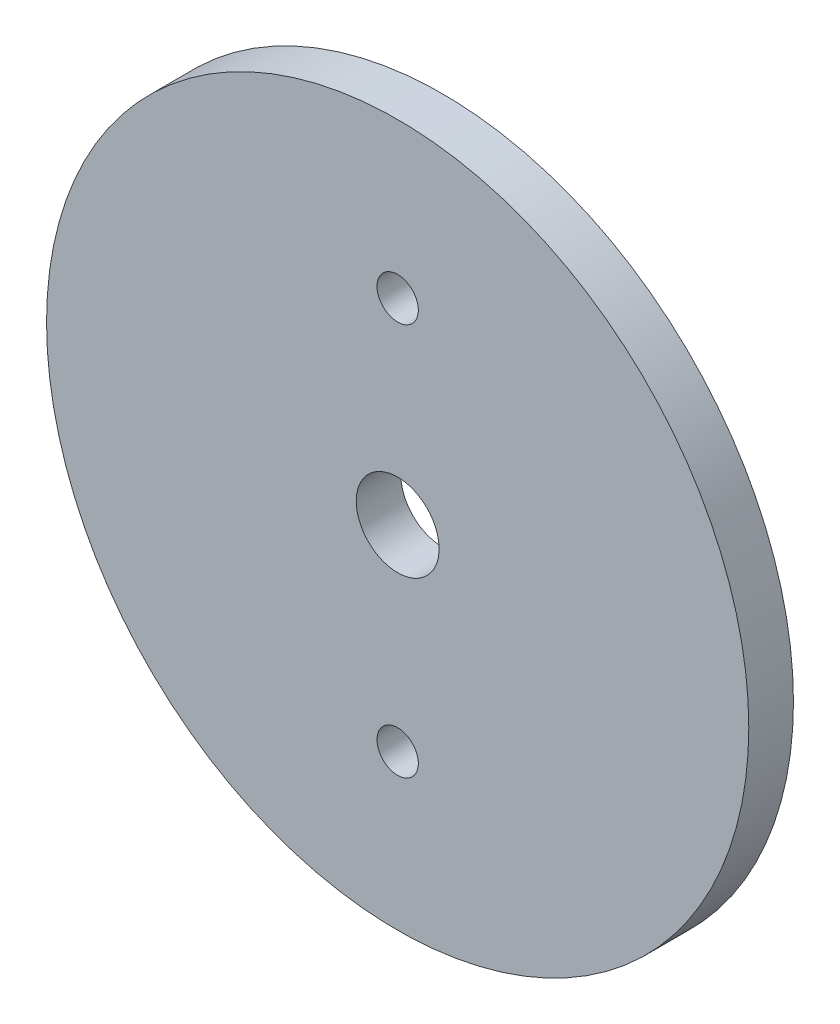
from build123d import *

# Parameters (mm, degrees)
SKETCH1_R           = 25
SKETCH1_R_2         = 2.95
SKETCH1_R_3         = 1.47
BOSS_EXTRUDE1_DEPTH = 3.18


with BuildPart() as part:
    # Sketch1 → Boss-Extrude1 (new body)
    with BuildSketch(Plane.XY):
        with Locations(Location((0, 0, 0), (0, 0, 180))):
            Circle(SKETCH1_R)
        with Locations(Location((0, 0, 0), (0, 0, 180))):
            Circle(SKETCH1_R_2, mode=Mode.SUBTRACT)
        with Locations(Location((0, 13.975, 0), (0, 0, 180))):
            Circle(SKETCH1_R_3, mode=Mode.SUBTRACT)
        with Locations(Location((0, -13.975, 0), (0, 0, 180))):
            Circle(SKETCH1_R_3, mode=Mode.SUBTRACT)
    extrude(amount=BOSS_EXTRUDE1_DEPTH)


solid = part.part
